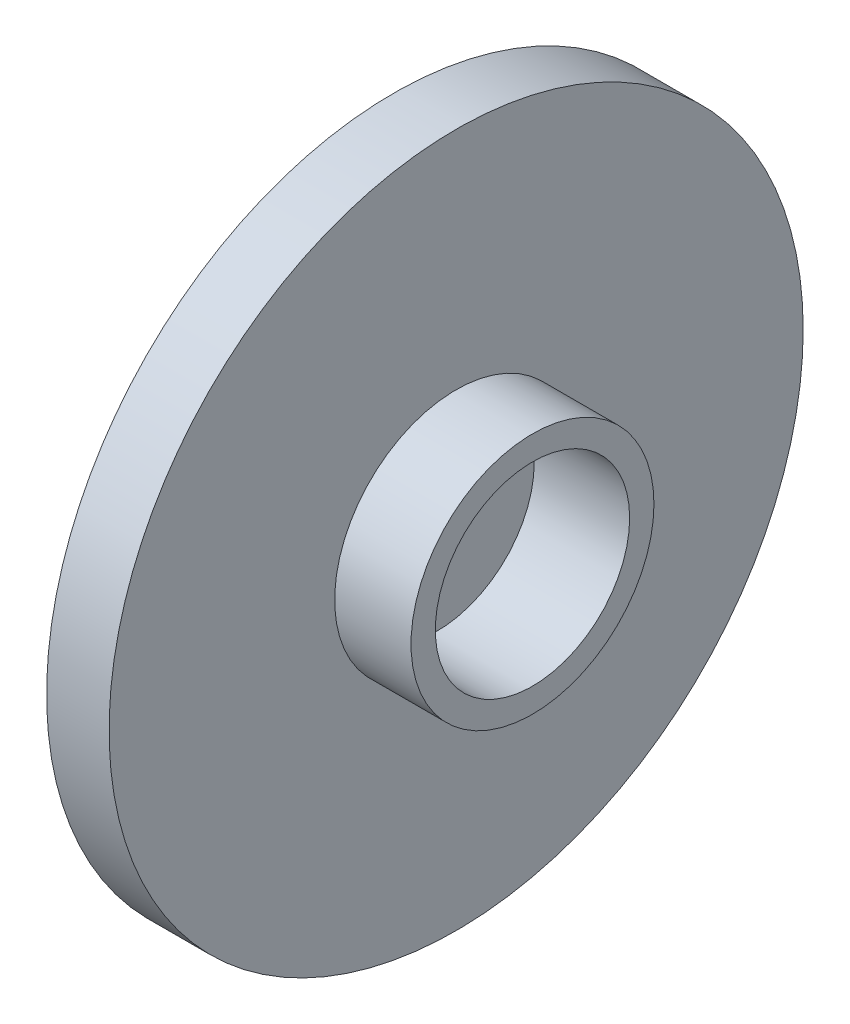
from build123d import *


with BuildPart() as part:
    # Sketch2 → Revolve1 (revolve)
    with BuildSketch(Plane(origin=(0, 0, 0), x_dir=(1, 0, 0), z_dir=(0, 1, 0))):
        Polygon((-2.75, 1), (-3.6, 1), (-3.6, 2.25), (-4.6, 2.25), (-4.6, 2.8), (-4, 2.8), (-4, 10), (-2.2, 10), (-2.2, 3.5), (0, 3.5), (0, 2.8), (-2.75, 2.8), align=None)
    revolve(axis=Axis((0, 0, 0), (-1, 0, 0)))


solid = part.part
